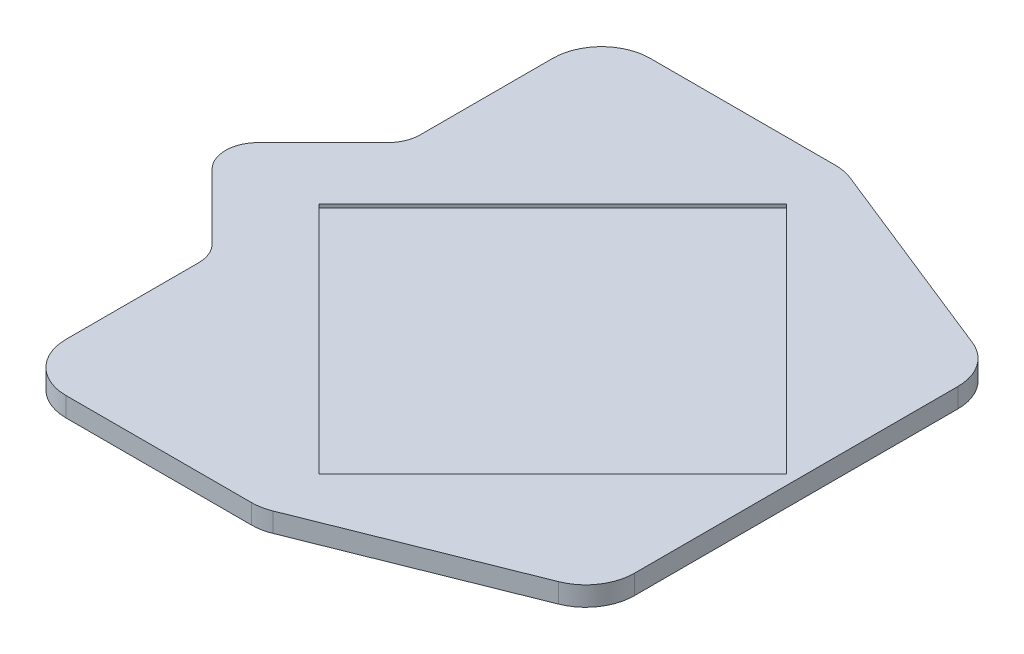
from build123d import *

# Parameters (mm, degrees)
SKETCH_1_W          = 12.5
SKETCH_1_H          = 30
EXTRUDE_1_DEPTH     = 1
SCALE_1_SCALE       = 1.2
FILLET_1_R          = 2
FILLET_2_R          = 3
FILLET_3_R          = 2
CUT_EXTRUDE_1_DEPTH = 0.2


with BuildPart() as part:
    # 草图1 → 凸台-拉伸1 (new body)
    with BuildSketch(Plane(origin=(0, 0, 0), x_dir=(1, 0, 0), z_dir=(0, 1, 0))):
        with Locations((6.25, -15)):
            Rectangle(SKETCH_1_W, SKETCH_1_H)
        Polygon((25, -5), (12.5, 0), (12.5, -30), (25, -25), align=None)
        Polygon((0, -15), (0, -10), (-5, -15), align=None)
        Polygon((0, -20), (0, -15), (-5, -15), align=None)
    extrude(amount=EXTRUDE_1_DEPTH)


with BuildPart() as part_1:
    # 缩放比例1: scaled about (11.271929825, 0.5, 15)
    add(part.part.scale(SCALE_1_SCALE).moved(Location((-2.254385965, -0.1, -3))))

    # 圆角1
    fillet_1_edges = [part_1.edges().sort_by_distance(p)[0] for p in [
        (-8.254385965, 0.5, 15),
    ]]
    fillet(fillet_1_edges, radius=FILLET_1_R)

    # 圆角2
    fillet_2_edges = [part_1.edges().sort_by_distance(p)[0] for p in [
        (-2.254385965, 0.5, -3),
        (12.745614035, 0.5, -3),
        (27.745614035, 0.5, 3),
        (27.745614035, 0.5, 27),
        (12.745614035, 0.5, 33),
        (-2.254385965, 0.5, 33),
    ]]
    fillet(fillet_2_edges, radius=FILLET_2_R)

    # 圆角3
    fillet_3_edges = [part_1.edges().sort_by_distance(p)[0] for p in [
        (-2.254385965, 0.5, 9),
        (-2.254385965, 0.5, 21),
    ]]
    fillet(fillet_3_edges, radius=FILLET_3_R)

    # 草图2 → 切除-拉伸1 (cut)
    with BuildSketch(Plane(origin=(0, 1.1, 0), x_dir=(1, 0, 0), z_dir=(0, 1, 0))):
        Polygon((27.146025588, -15), (12.735189388, -0.589163799), (-1.675646813, -15), (12.735189388, -29.410836201), align=None)
    extrude(amount=-CUT_EXTRUDE_1_DEPTH, mode=Mode.SUBTRACT)


solid = part_1.part
